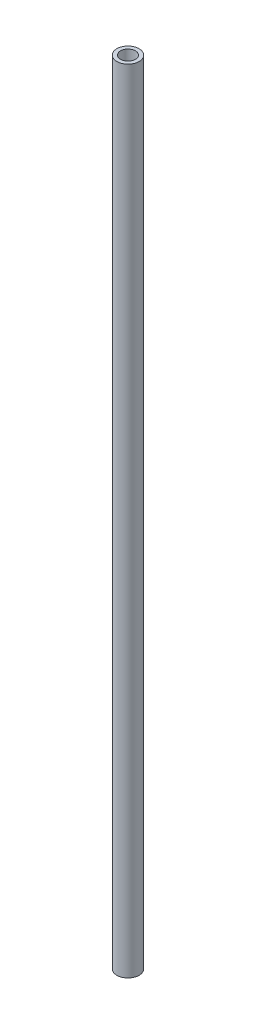
from build123d import *

# Parameters (mm, degrees)
SKETCH1_R           = 2.25
SKETCH1_R_2         = 1.5
BOSS_EXTRUDE1_DEPTH = 160


with BuildPart() as part:
    # Sketch1 → Boss-Extrude1 (new body)
    with BuildSketch(Plane(origin=(0, 0, 0), x_dir=(1, 0, 0), z_dir=(0, 1, 0))):
        with Locations(Location((0, 0, 0), (0, 0, 270))):
            Circle(SKETCH1_R)
        with Locations(Location((0, 0, 0), (0, 0, 270))):
            Circle(SKETCH1_R_2, mode=Mode.SUBTRACT)
    extrude(amount=BOSS_EXTRUDE1_DEPTH)


solid = part.part
